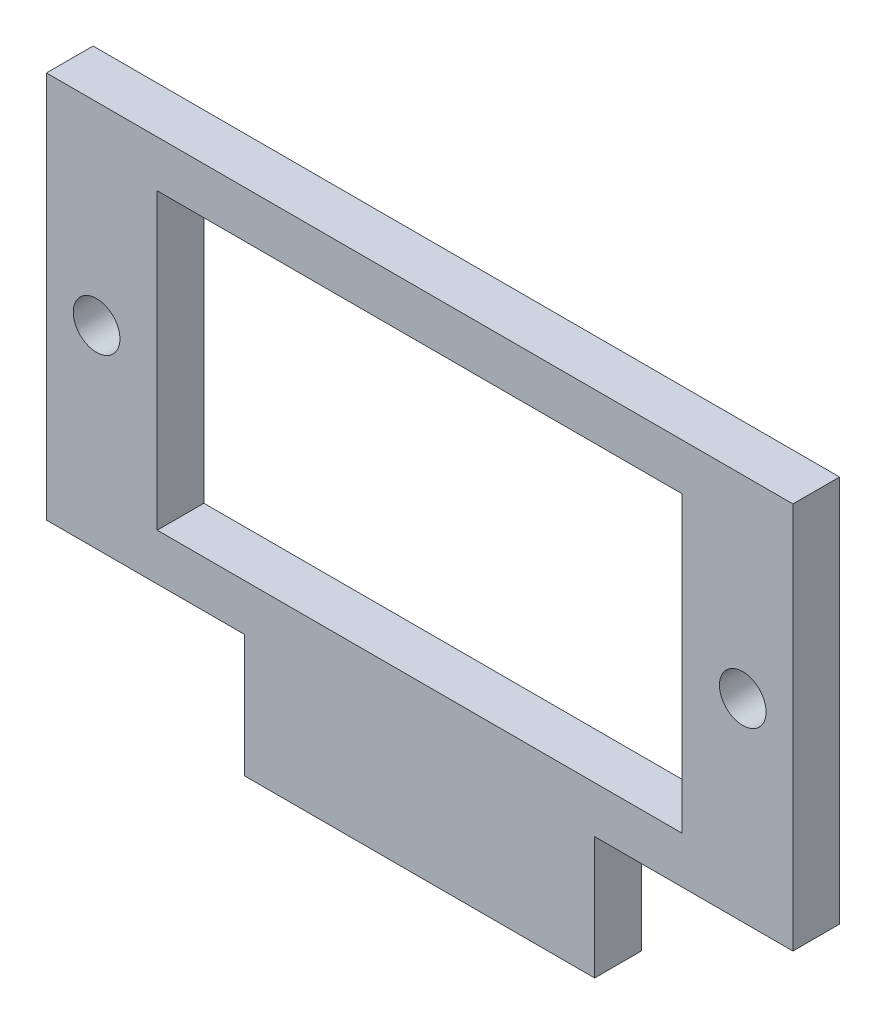
from build123d import *

# Parameters (mm, degrees)
SKETCH1_W           = 32
SKETCH1_H           = 16.6
SKETCH1_R           = 1
SKETCH1_W_2         = 22.5
SKETCH1_H_2         = 12.6
BOSS_EXTRUDE1_DEPTH = 2
SKETCH2_W           = 15
SKETCH2_H           = 2
BOSS_EXTRUDE2_DEPTH = 5.25


with BuildPart() as part:
    # Sketch1 → Boss-Extrude1 (new body)
    with BuildSketch(Plane.XY):
        Rectangle(SKETCH1_W, SKETCH1_H)
        with Locations((-13.85, 0)):
            Circle(SKETCH1_R, mode=Mode.SUBTRACT)
        with Locations((13.85, 0)):
            Circle(SKETCH1_R, mode=Mode.SUBTRACT)
        Rectangle(SKETCH1_W_2, SKETCH1_H_2, mode=Mode.SUBTRACT)
    extrude(amount=BOSS_EXTRUDE1_DEPTH)

    # Sketch2 → Boss-Extrude2 (add)
    with BuildSketch(Plane.XZ.offset(8.3)):
        with Locations((0, 1)):
            Rectangle(SKETCH2_W, SKETCH2_H)
    extrude(amount=BOSS_EXTRUDE2_DEPTH)


solid = part.part
